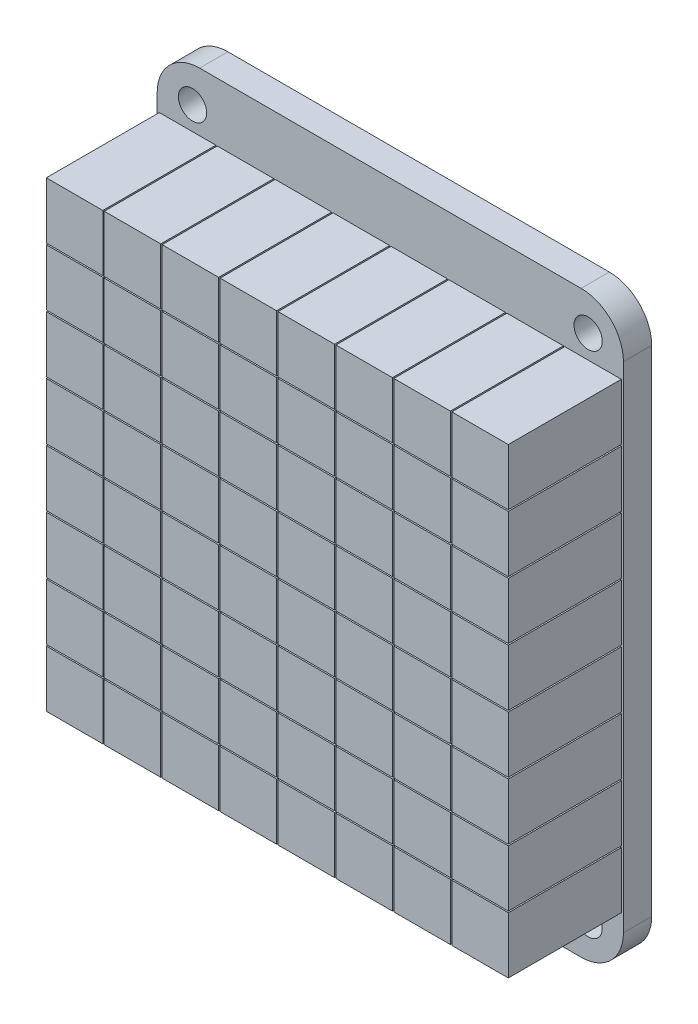
from build123d import *

# Parameters (mm, degrees)
SKETCH1_W           = 33
SKETCH1_H           = 41
BOSS_EXTRUDE1_DEPTH = 2
SKETCH5_W           = 4
SKETCH5_H           = 4
BOSS_EXTRUDE2_DEPTH = 8
FILLET1_R           = 3
SKETCH6_R           = 1
CUT_EXTRUDE2_DEPTH  = 2


with BuildPart() as part:
    # Sketch1 → Boss-Extrude1 (new body)
    with BuildSketch(Plane.XY):
        with Locations((16.5, 20.5)):
            Rectangle(SKETCH1_W, SKETCH1_H)
    extrude(amount=BOSS_EXTRUDE1_DEPTH)

    # Sketch5 → Boss-Extrude2 (add)
    with BuildSketch(Plane.XY.offset(2)):
        with Locations((6.25, 34.85)):
            Rectangle(SKETCH5_W, SKETCH5_H)
        with Locations((2.15, 34.85)):
            Rectangle(SKETCH5_W, SKETCH5_H)
        with Locations((10.35, 34.85)):
            Rectangle(SKETCH5_W, SKETCH5_H)
        with Locations((14.45, 34.85)):
            Rectangle(SKETCH5_W, SKETCH5_H)
        with Locations((18.55, 34.85)):
            Rectangle(SKETCH5_W, SKETCH5_H)
        with Locations((22.65, 34.85)):
            Rectangle(SKETCH5_W, SKETCH5_H)
        with Locations((26.75, 34.85)):
            Rectangle(SKETCH5_W, SKETCH5_H)
        with Locations((30.85, 34.85)):
            Rectangle(SKETCH5_W, SKETCH5_H)
        with Locations((6.25, 30.75)):
            Rectangle(SKETCH5_W, SKETCH5_H)
        with Locations((10.35, 30.75)):
            Rectangle(SKETCH5_W, SKETCH5_H)
        with Locations((14.45, 30.75)):
            Rectangle(SKETCH5_W, SKETCH5_H)
        with Locations((18.55, 30.75)):
            Rectangle(SKETCH5_W, SKETCH5_H)
        with Locations((22.65, 30.75)):
            Rectangle(SKETCH5_W, SKETCH5_H)
        with Locations((26.75, 30.75)):
            Rectangle(SKETCH5_W, SKETCH5_H)
        with Locations((30.85, 30.75)):
            Rectangle(SKETCH5_W, SKETCH5_H)
        with Locations((6.25, 26.65)):
            Rectangle(SKETCH5_W, SKETCH5_H)
        with Locations((10.35, 26.65)):
            Rectangle(SKETCH5_W, SKETCH5_H)
        with Locations((14.45, 26.65)):
            Rectangle(SKETCH5_W, SKETCH5_H)
        with Locations((18.55, 26.65)):
            Rectangle(SKETCH5_W, SKETCH5_H)
        with Locations((22.65, 26.65)):
            Rectangle(SKETCH5_W, SKETCH5_H)
        with Locations((26.75, 26.65)):
            Rectangle(SKETCH5_W, SKETCH5_H)
        with Locations((30.85, 26.65)):
            Rectangle(SKETCH5_W, SKETCH5_H)
        with Locations((6.25, 22.55)):
            Rectangle(SKETCH5_W, SKETCH5_H)
        with Locations((10.35, 22.55)):
            Rectangle(SKETCH5_W, SKETCH5_H)
        with Locations((14.45, 22.55)):
            Rectangle(SKETCH5_W, SKETCH5_H)
        with Locations((18.55, 22.55)):
            Rectangle(SKETCH5_W, SKETCH5_H)
        with Locations((22.65, 22.55)):
            Rectangle(SKETCH5_W, SKETCH5_H)
        with Locations((26.75, 22.55)):
            Rectangle(SKETCH5_W, SKETCH5_H)
        with Locations((30.85, 22.55)):
            Rectangle(SKETCH5_W, SKETCH5_H)
        with Locations((6.25, 18.45)):
            Rectangle(SKETCH5_W, SKETCH5_H)
        with Locations((10.35, 18.45)):
            Rectangle(SKETCH5_W, SKETCH5_H)
        with Locations((14.45, 18.45)):
            Rectangle(SKETCH5_W, SKETCH5_H)
        with Locations((18.55, 18.45)):
            Rectangle(SKETCH5_W, SKETCH5_H)
        with Locations((22.65, 18.45)):
            Rectangle(SKETCH5_W, SKETCH5_H)
        with Locations((26.75, 18.45)):
            Rectangle(SKETCH5_W, SKETCH5_H)
        with Locations((30.85, 18.45)):
            Rectangle(SKETCH5_W, SKETCH5_H)
        with Locations((6.25, 14.35)):
            Rectangle(SKETCH5_W, SKETCH5_H)
        with Locations((10.35, 14.35)):
            Rectangle(SKETCH5_W, SKETCH5_H)
        with Locations((14.45, 14.35)):
            Rectangle(SKETCH5_W, SKETCH5_H)
        with Locations((18.55, 14.35)):
            Rectangle(SKETCH5_W, SKETCH5_H)
        with Locations((22.65, 14.35)):
            Rectangle(SKETCH5_W, SKETCH5_H)
        with Locations((26.75, 14.35)):
            Rectangle(SKETCH5_W, SKETCH5_H)
        with Locations((30.85, 14.35)):
            Rectangle(SKETCH5_W, SKETCH5_H)
        with Locations((6.25, 10.25)):
            Rectangle(SKETCH5_W, SKETCH5_H)
        with Locations((10.35, 10.25)):
            Rectangle(SKETCH5_W, SKETCH5_H)
        with Locations((14.45, 10.25)):
            Rectangle(SKETCH5_W, SKETCH5_H)
        with Locations((18.55, 10.25)):
            Rectangle(SKETCH5_W, SKETCH5_H)
        with Locations((22.65, 10.25)):
            Rectangle(SKETCH5_W, SKETCH5_H)
        with Locations((26.75, 10.25)):
            Rectangle(SKETCH5_W, SKETCH5_H)
        with Locations((30.85, 10.25)):
            Rectangle(SKETCH5_W, SKETCH5_H)
        with Locations((6.25, 6.15)):
            Rectangle(SKETCH5_W, SKETCH5_H)
        with Locations((10.35, 6.15)):
            Rectangle(SKETCH5_W, SKETCH5_H)
        with Locations((14.45, 6.15)):
            Rectangle(SKETCH5_W, SKETCH5_H)
        with Locations((18.55, 6.15)):
            Rectangle(SKETCH5_W, SKETCH5_H)
        with Locations((22.65, 6.15)):
            Rectangle(SKETCH5_W, SKETCH5_H)
        with Locations((26.75, 6.15)):
            Rectangle(SKETCH5_W, SKETCH5_H)
        with Locations((30.85, 6.15)):
            Rectangle(SKETCH5_W, SKETCH5_H)
        with Locations((2.15, 30.75)):
            Rectangle(SKETCH5_W, SKETCH5_H)
        with Locations((2.15, 26.65)):
            Rectangle(SKETCH5_W, SKETCH5_H)
        with Locations((2.15, 22.55)):
            Rectangle(SKETCH5_W, SKETCH5_H)
        with Locations((2.15, 18.45)):
            Rectangle(SKETCH5_W, SKETCH5_H)
        with Locations((2.15, 14.35)):
            Rectangle(SKETCH5_W, SKETCH5_H)
        with Locations((2.15, 10.25)):
            Rectangle(SKETCH5_W, SKETCH5_H)
        with Locations((2.15, 6.15)):
            Rectangle(SKETCH5_W, SKETCH5_H)
    extrude(amount=BOSS_EXTRUDE2_DEPTH)

    # Fillet1
    fillet1_edges = [part.edges().sort_by_distance(p)[0] for p in [
        (0, 41, 1),
        (33, 41, 1),
        (33, 0, 1),
        (0, 0, 1),
    ]]
    fillet(fillet1_edges, radius=FILLET1_R)

    # Sketch6 → Cut-Extrude2 (cut)
    with BuildSketch(Plane.XY.offset(2)):
        with Locations((2.5, 38.5)):
            Circle(SKETCH6_R)
        with Locations((30.5, 38.5)):
            Circle(SKETCH6_R)
        with Locations((30.5, 2.5)):
            Circle(SKETCH6_R)
        with Locations((2.5, 2.5)):
            Circle(SKETCH6_R)
    extrude(amount=-CUT_EXTRUDE2_DEPTH, mode=Mode.SUBTRACT)


solid = part.part
